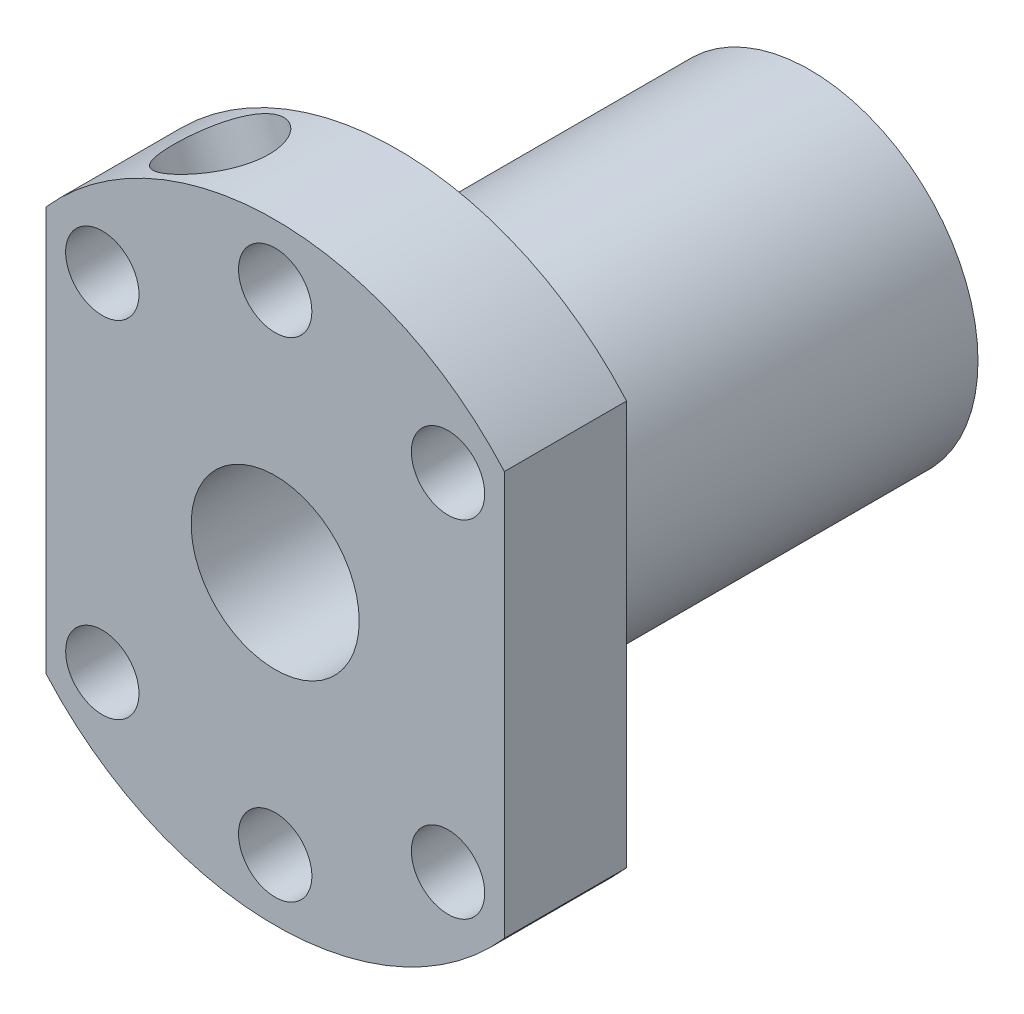
from build123d import *

# Parameters (mm, degrees)
SKETCH1_R                  = 5.5
SKETCH1_R_2                = 2.4
BOSS_EXTRUDE1_DEPTH        = 4
BOSS_EXTRUDE2_START        = 27
SKETCH2_R                  = 11
SKETCH2_R_2                = 5.5
BOSS_EXTRUDE2_DEPTH        = 27
M8X1_25_TAPPED_HOLE1_D     = 6.8
M8X1_25_TAPPED_HOLE1_DEPTH = 8
M8X1_25_TAPPED_HOLE1_TIP   = 2.042926105


with BuildPart() as part:
    # Sketch1 → Boss-Extrude1 (new, symmetric)
    with BuildSketch(Plane.XY):
        with BuildLine():
            Line((-15, 13.228756555), (-15, -13.228756555))
            ThreePointArc((-15, -13.228756555), (0, -20), (15, -13.228756555))
            Line((15, -13.228756555), (15, 13.228756555))
            ThreePointArc((15, 13.228756555), (0, 20), (-15, 13.228756555))
        make_face()
        Circle(SKETCH1_R, mode=Mode.SUBTRACT)
        with Locations((-11.313708499, 11.313708499)):
            Circle(SKETCH1_R_2, mode=Mode.SUBTRACT)
        with Locations((0, 16)):
            Circle(SKETCH1_R_2, mode=Mode.SUBTRACT)
        with Locations(Location((11.313708499, 11.313708499, 0), (0, 0, 180))):
            Circle(SKETCH1_R_2, mode=Mode.SUBTRACT)
        with Locations((11.313708499, -11.313708499)):
            Circle(SKETCH1_R_2, mode=Mode.SUBTRACT)
        with Locations(Location((0, -16, 0), (0, 0, 180))):
            Circle(SKETCH1_R_2, mode=Mode.SUBTRACT)
        with Locations(Location((-11.313708499, -11.313708499, 0), (0, 0, 180))):
            Circle(SKETCH1_R_2, mode=Mode.SUBTRACT)
    extrude(amount=BOSS_EXTRUDE1_DEPTH, both=True)

    # Sketch2 → Boss-Extrude2 (add)
    with BuildSketch(Plane(origin=(0, 0, -4), x_dir=(-1, 0, 0), z_dir=(0, 0, -1)).offset(BOSS_EXTRUDE2_START)):
        with Locations(Location((0, 0, 0), (0, 0, 180))):
            Circle(SKETCH2_R)
        with Locations(Location((0, 0, 0), (0, 0, 180))):
            Circle(SKETCH2_R_2, mode=Mode.SUBTRACT)
    extrude(amount=-BOSS_EXTRUDE2_DEPTH)

    # M8x1.25 Tapped Hole1
    with Locations(Plane(origin=(-7.653668647, 18.47759065, 0), x_dir=(0.923879532511, 0.382683432365, 0), z_dir=(-0.382683432365, 0.923879532511, 0))):
        with Locations((0, 0)):
            Hole(M8X1_25_TAPPED_HOLE1_D / 2, depth=M8X1_25_TAPPED_HOLE1_DEPTH)
            with Locations((0, 0, -(M8X1_25_TAPPED_HOLE1_DEPTH + M8X1_25_TAPPED_HOLE1_TIP / 2))):  # 118° drill point
                Cone(0, M8X1_25_TAPPED_HOLE1_D / 2, M8X1_25_TAPPED_HOLE1_TIP, mode=Mode.SUBTRACT)


solid = part.part
